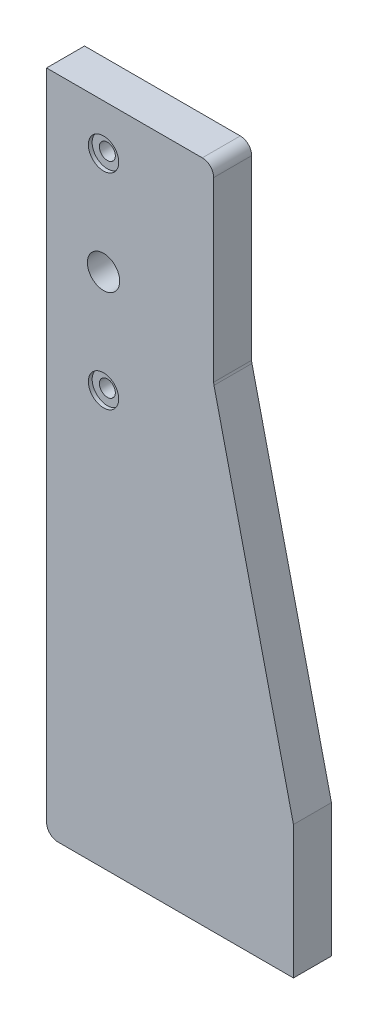
from build123d import *

# Parameters (mm, degrees)
EXTRUDE_1_DEPTH     = 10
SKETCH_6_R          = 2.1
CUT_EXTRUDE_5_DEPTH = 187.949190958
SKETCH_7_R          = 4
CUT_EXTRUDE_6_DEPTH = 1
FILLET_1_R          = 3
SKETCH_8_R          = 4.25
CUT_EXTRUDE_7_DEPTH = 10


with BuildPart() as part:
    # 草图5 → 凸台-拉伸1 (new body)
    with BuildSketch(Plane.XY):
        Polygon((0, 0), (0, 175), (44, 175), (44, 125), (65, 35), (65, 0), align=None)
    extrude(amount=EXTRUDE_1_DEPTH)

    # 草图6 → 切除-拉伸5 (cut, through all)
    with BuildSketch(Plane.XY.offset(10)):
        with Locations((15, 163)):
            Circle(SKETCH_6_R)
        with Locations((15, 109)):
            Circle(SKETCH_6_R)
    extrude(amount=-CUT_EXTRUDE_5_DEPTH, mode=Mode.SUBTRACT)

    # 草图7 → 切除-拉伸6 (cut)
    with BuildSketch(Plane.XY.offset(10)):
        with Locations((15, 163)):
            Circle(SKETCH_7_R)
        with Locations((15, 109)):
            Circle(SKETCH_7_R)
    extrude(amount=-CUT_EXTRUDE_6_DEPTH, mode=Mode.SUBTRACT)

    # 圆角1
    fillet_1_edges = [part.edges().sort_by_distance(p)[0] for p in [
        (0, 0, 5),
        (44, 175, 5),
        (44, 125, 5),
    ]]
    fillet(fillet_1_edges, radius=FILLET_1_R)

    # 草图8 → 切除-拉伸7 (cut)
    with BuildSketch(Plane.XY.offset(10)):
        with Locations((15, 136)):
            Circle(SKETCH_8_R)
    extrude(amount=-CUT_EXTRUDE_7_DEPTH, mode=Mode.SUBTRACT)


solid = part.part
